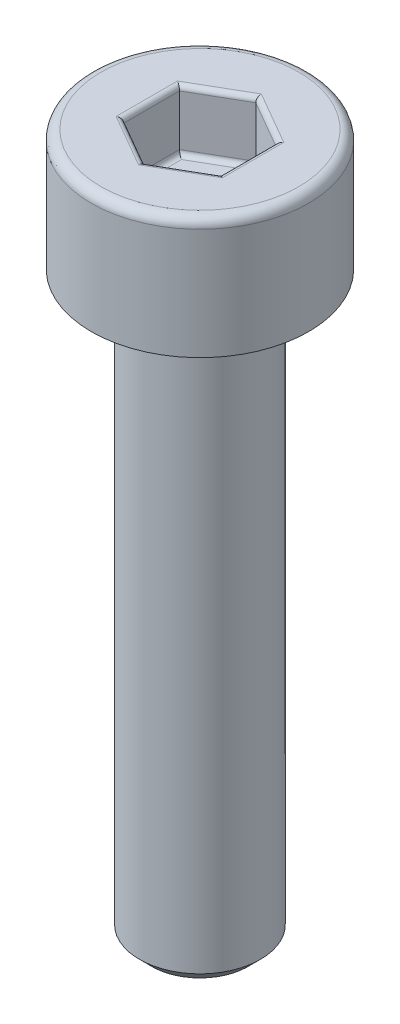
from build123d import *

# Parameters (mm, degrees)
CHAMFER1_SIZE      = 0.25
FILLET1_R          = 0.2
CUT_EXTRUDE1_DEPTH = 1.25
FILLET2_R          = 0.1


with BuildPart() as part:
    # Sketch1 → Revolve1 (revolve)
    with BuildSketch(Plane.XY, mode=Mode.PRIVATE) as revolve1_sk:
        Polygon((0, -14.5), (-1.25, -14.5), (-1.25, -2.5), (-2.25, -2.5), (-2.25, 0), (0, 0), align=None)
    revolve(revolve1_sk.sketch.rotate(Axis((0, 0, 0), (0, -1, 0)), 270), axis=Axis((0, 0, 0), (0, -1, 0)))

    # Chamfer1
    chamfer1_edges = [part.edges().sort_by_distance(p)[0] for p in [
        (0, -2.5, -1.25),
        (0, -14.5, -1.25),
    ]]
    chamfer(chamfer1_edges, length=CHAMFER1_SIZE)

    # Fillet1
    fillet1_edges = [part.edges().sort_by_distance(p)[0] for p in [
        (0, 0, -2.25),
    ]]
    fillet(fillet1_edges, radius=FILLET1_R)

    # Sketch2 → Cut-Extrude1 (cut)
    with BuildSketch(Plane(origin=(0, 0, 0), x_dir=(1, 0, 0), z_dir=(0, 1, 0))):
        Polygon((0, 1.154700538), (-1, 0.577350269), (-1, -0.577350269), (0, -1.154700538), (1, -0.577350269), (1, 0.577350269), align=None)
    extrude(amount=-CUT_EXTRUDE1_DEPTH, mode=Mode.SUBTRACT)

    # Fillet2
    fillet2_edges = [part.edges().sort_by_distance(p)[0] for p in [
        (0.5, -1.25, -0.866025404),
        (1, -1.25, 0),
        (0.5, -1.25, 0.866025404),
        (-0.5, -1.25, 0.866025404),
        (-1, -1.25, 0),
        (-0.5, -1.25, -0.866025404),
        (0.4999999999999987, 0, -0.8660254037844397),
        (-0.5000000000000006, 0, -0.8660254037844395),
        (-1, 0, 0),
        (-0.5000000000000007, 0, 0.8660254037844379),
        (0.4999999999999988, 0, 0.8660254037844382),
        (1, 0, 0),
    ]]
    fillet(fillet2_edges, radius=FILLET2_R)


solid = part.part
